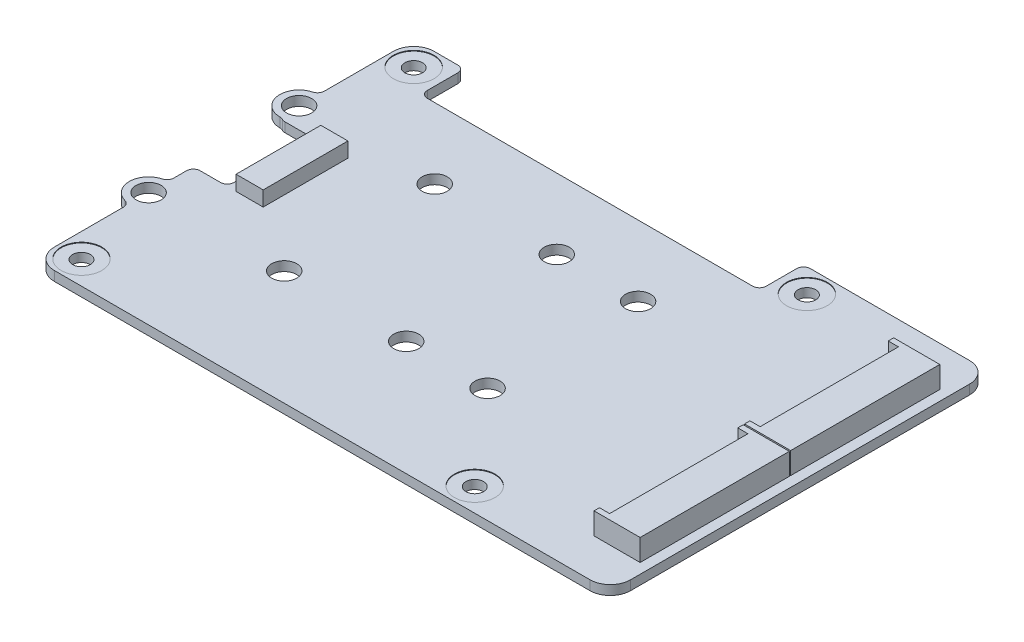
from build123d import *

# Parameters (mm, degrees)
SKETCH_1_W          = 85
SKETCH_1_H          = 56
EXTRUDE_1_DEPTH     = 1.4
FILLET_1_R          = 3
SKETCH_2_R          = 1.3
CUT_EXTRUDE_1_DEPTH = 1.5
SKETCH_7_R          = 3
CUT_EXTRUDE_4_DEPTH = 0.1
SKETCH_3_W          = 5
SKETCH_3_H          = 12.5
CUT_EXTRUDE_2_DEPTH = 1.5
FILLET_2_R          = 1
SKETCH_8_W          = 50
SKETCH_8_H          = 6.5
CUT_EXTRUDE_5_DEPTH = 54.614950043
FILLET_3_R          = 1
SKETCH_4_W          = 6.8
SKETCH_4_H          = 22
EXTRUDE_2_DEPTH     = 3.2
SKETCH_5_W          = 1.5
SKETCH_5_H          = 20.4
CUT_EXTRUDE_3_DEPTH = 1.8
SKETCH_6_W          = 4
SKETCH_6_H          = 12.5
EXTRUDE_3_DEPTH     = 2.2
SKETCH_10_R         = 2.85
EXTRUDE_4_DEPTH     = 1.4
SKETCH_9_R          = 1.85
CUT_EXTRUDE_6_DEPTH = 56.978914621
FILLET_4_R          = 1


with BuildPart() as part:
    # 草图1 → 凸台-拉伸1 (new body)
    with BuildSketch(Plane(origin=(0, 0, 0), x_dir=(1, 0, 0), z_dir=(0, 1, 0))):
        with Locations((-0.074300699, -4.558129371)):
            Rectangle(SKETCH_1_W, SKETCH_1_H)
    extrude(amount=EXTRUDE_1_DEPTH)

    # 圆角1
    fillet_1_edges = [part.edges().sort_by_distance(p)[0] for p in [
        (-42.574300699, 0.7, -23.441870629),
        (42.425699301, 0.7, -23.441870629),
        (42.425699301, 0.7, 32.558129371),
        (-42.574300699, 0.7, 32.558129371),
    ]]
    fillet(fillet_1_edges, radius=FILLET_1_R)

    # 草图2 → 切除-拉伸1 (cut)
    with BuildSketch(Plane(origin=(0, 1.4, 0), x_dir=(1, 0, 0), z_dir=(0, 1, 0))):
        with Locations(Location((-39.074300699, 19.941870629, 0), (0, 0, 270))):
            Circle(SKETCH_2_R)
        with Locations(Location((-39.074300699, -29.058129371, 0), (0, 0, 270))):
            Circle(SKETCH_2_R)
        with Locations(Location((18.925699301, -29.058129371, 0), (0, 0, 270))):
            Circle(SKETCH_2_R)
        with Locations(Location((18.925699301, 19.941870629, 0), (0, 0, 270))):
            Circle(SKETCH_2_R)
    extrude(amount=-CUT_EXTRUDE_1_DEPTH, mode=Mode.SUBTRACT)

    # 草图7 → 切除-拉伸4 (cut)
    with BuildSketch(Plane(origin=(0, 1.4, 0), x_dir=(1, 0, 0), z_dir=(0, 1, 0))):
        with Locations(Location((-39.074300699, 19.941870629, 0), (0, 0, 270))):
            Circle(SKETCH_7_R)
        with Locations(Location((18.925699301, 19.941870629, 0), (0, 0, 270))):
            Circle(SKETCH_7_R)
        with Locations(Location((-39.074300699, -29.058129371, 0), (0, 0, 270))):
            Circle(SKETCH_7_R)
        with Locations(Location((18.925699301, -29.058129371, 0), (0, 0, 270))):
            Circle(SKETCH_7_R)
    extrude(amount=-CUT_EXTRUDE_4_DEPTH, mode=Mode.SUBTRACT)

    # 草图3 → 切除-拉伸2 (cut)
    with BuildSketch(Plane(origin=(0, 1.4, 0), x_dir=(1, 0, 0), z_dir=(0, 1, 0))):
        with Locations((-40.074300699, -2.808129371)):
            Rectangle(SKETCH_3_W, SKETCH_3_H)
    extrude(amount=-CUT_EXTRUDE_2_DEPTH, mode=Mode.SUBTRACT)

    # 圆角2
    fillet_2_edges = [part.edges().sort_by_distance(p)[0] for p in [
        (-42.574300699, 0.7, 9.058129371),
        (-42.574300699, 0.7, -3.441870629),
        (-37.574300699, 0.7, -3.441870629),
        (-37.574300699, 0.7, 9.058129371),
    ]]
    fillet(fillet_2_edges, radius=FILLET_2_R)

    # 草图8 → 切除-拉伸5 (cut, through all)
    with BuildSketch(Plane(origin=(0, 1.4, 0), x_dir=(1, 0, 0), z_dir=(0, 1, 0))):
        with Locations((-10.074300699, 20.191870629)):
            Rectangle(SKETCH_8_W, SKETCH_8_H)
    extrude(amount=-CUT_EXTRUDE_5_DEPTH, mode=Mode.SUBTRACT)

    # 圆角3
    fillet_3_edges = [part.edges().sort_by_distance(p)[0] for p in [
        (-35.074300699, 0.7, -16.941870629),
        (-35.074300699, 0.7, -23.441870629),
        (14.925699301, 0.7, -23.441870629),
        (14.925699301, 0.7, -16.941870629),
    ]]
    fillet(fillet_3_edges, radius=FILLET_3_R)

    # 草图4 → 凸台-拉伸2 (add)
    with BuildSketch(Plane(origin=(0, 1.4, 0), x_dir=(1, 0, 0), z_dir=(0, 1, 0))):
        with Locations((37.525699301, 6.541870629)):
            Rectangle(SKETCH_4_W, SKETCH_4_H)
        with Locations((37.525699301, -15.658129371)):
            Rectangle(SKETCH_4_W, SKETCH_4_H)
    extrude(amount=EXTRUDE_2_DEPTH)

    # 草图5 → 切除-拉伸3 (cut)
    with BuildSketch(Plane(origin=(0, 4.6, 0), x_dir=(1, 0, 0), z_dir=(0, 1, 0))):
        with Locations((34.875699301, 6.541870629)):
            Rectangle(SKETCH_5_W, SKETCH_5_H)
        with Locations((34.875699301, -15.658129371)):
            Rectangle(SKETCH_5_W, SKETCH_5_H)
    extrude(amount=-CUT_EXTRUDE_3_DEPTH, mode=Mode.SUBTRACT)

    # 草图6 → 凸台-拉伸3 (add)
    with BuildSketch(Plane(origin=(0, 1.4, 0), x_dir=(1, 0, 0), z_dir=(0, 1, 0))):
        with Locations((-34.274300699, -2.808129371)):
            Rectangle(SKETCH_6_W, SKETCH_6_H)
    extrude(amount=EXTRUDE_3_DEPTH)

    # 草图10 → 凸台-拉伸4 (add)
    with BuildSketch(Plane(origin=(0, 1.4, 0), x_dir=(1, 0, 0), z_dir=(0, 1, 0))):
        with Locations((-42.574300699, 6.541870629)):
            Circle(SKETCH_10_R)
        with Locations((-42.574300699, -15.658129371)):
            Circle(SKETCH_10_R)
    extrude(amount=-EXTRUDE_4_DEPTH)

    # 草图9 → 切除-拉伸6 (cut, through all)
    with BuildSketch(Plane(origin=(0, 1.4, 0), x_dir=(1, 0, 0), z_dir=(0, 1, 0))):
        with Locations(Location((7.425699301, 6.541870629, 0), (0, 0, 270))):
            Circle(SKETCH_9_R)
        with Locations(Location((-4.574300699, 6.541870629, 0), (0, 0, 270))):
            Circle(SKETCH_9_R)
        with Locations(Location((-22.574300699, 6.541870629, 0), (0, 0, 270))):
            Circle(SKETCH_9_R)
        with Locations(Location((-22.574300699, -15.658129371, 0), (0, 0, 270))):
            Circle(SKETCH_9_R)
        with Locations(Location((-4.574300699, -15.658129371, 0), (0, 0, 270))):
            Circle(SKETCH_9_R)
        with Locations(Location((7.425699301, -15.658129371, 0), (0, 0, 270))):
            Circle(SKETCH_9_R)
        with Locations(Location((-42.574300699, 6.541870629, 0), (0, 0, 270))):
            Circle(SKETCH_9_R)
        with Locations(Location((-42.574300699, -15.658129371, 0), (0, 0, 270))):
            Circle(SKETCH_9_R)
    extrude(amount=-CUT_EXTRUDE_6_DEPTH, mode=Mode.SUBTRACT)

    # 圆角4
    fillet_4_edges = [part.edges().sort_by_distance(p)[0] for p in [
        (-42.255485289, 0.7, -3.70975892),
        (-42.574300699, 0.7, -9.391870629),
        (-42.574300699, 0.7, 12.808129371),
        (-42.574300699, 0.7, 18.508129371),
    ]]
    fillet(fillet_4_edges, radius=FILLET_4_R)


solid = part.part
